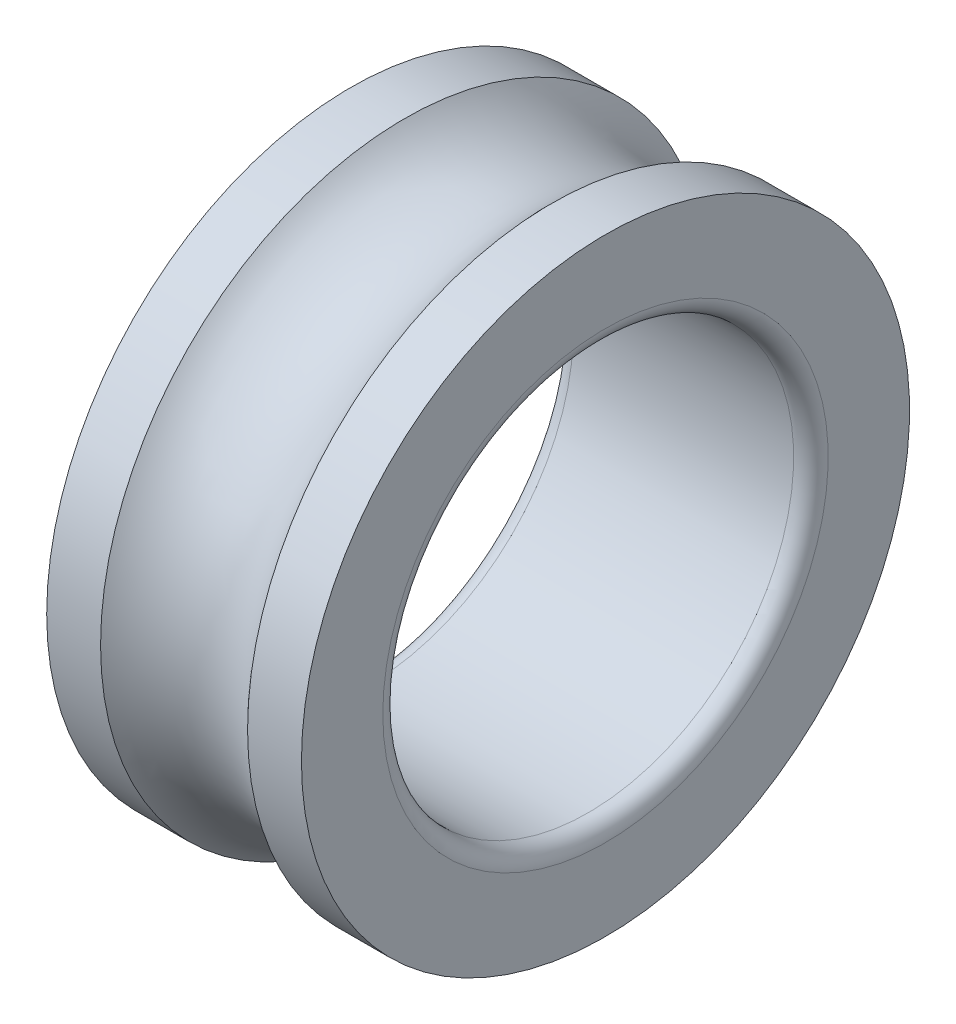
from build123d import *


with BuildPart() as part:
    # Sketch1 → Revolve1 (revolve)
    with BuildSketch(Plane.XY, mode=Mode.PRIVATE) as revolve1_sk:
        with BuildLine():
            Line((-13.4, 25), (13.4, 25))
            ThreePointArc((13.4, 25), (14.88492424, 25.61507576), (15.5, 27.1))
            Line((15.5, 27.1), (15.5, 37))
            Line((15.5, 37), (8.94427191, 37))
            ThreePointArc((8.94427191, 37), (0, 33), (-8.94427191, 37))
            Line((-8.94427191, 37), (-15.5, 37))
            Line((-15.5, 37), (-15.5, 27.1))
            ThreePointArc((-15.5, 27.1), (-14.88492424, 25.61507576), (-13.4, 25))
        make_face()
    revolve(revolve1_sk.sketch.rotate(Axis((-46.384328358, 0, 0), (1, 0, 0)), 90), axis=Axis((-46.384328358, 0, 0), (1, 0, 0)))


solid = part.part
